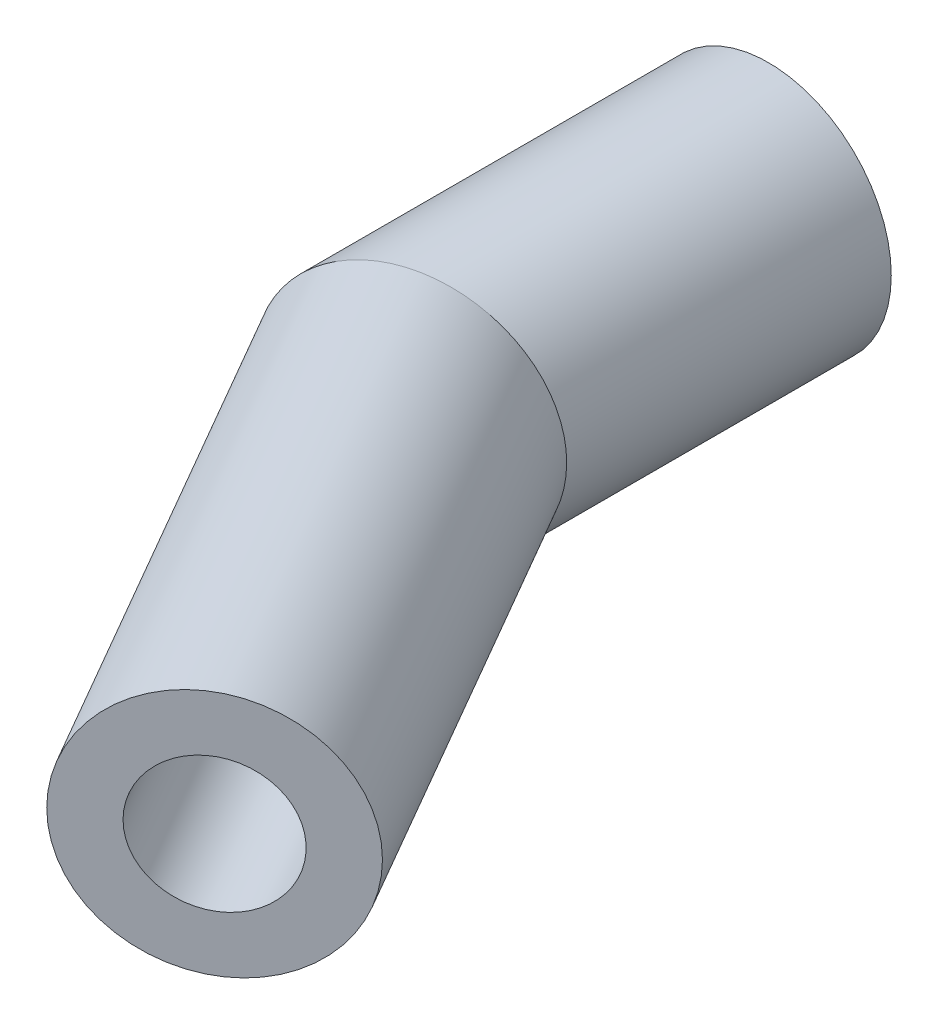
from build123d import *

# Parameters (mm, degrees)
SWEEP1_PROFILE_R     = 8.73125
CUT_SWEEP1_PROFILE_R = 4.7625


with BuildPart() as part:
    # Sweep1: sweep along a curve in space
    with BuildLine() as sweep1_path:
        Line((0, 0, 0), (0, 0, 25.4))
        Line((0, 0, 25.4), (19.05, 0, 58.395567884))
    # Sweep1 profile (on start of the path) → Sweep1 (sweep)
    with BuildSketch(Plane.XY):
        Circle(SWEEP1_PROFILE_R)
    sweep(path=sweep1_path.line, transition=Transition.RIGHT)

    # Cut-Sweep1: sweep along a curve in space
    with BuildLine() as cut_sweep1_path:
        Line((0, 0, 0), (0, 0, 25.4))
        Line((0, 0, 25.4), (19.05, 0, 58.395567884))
    # Cut-Sweep1 profile (on start of the path) → Cut-Sweep1 (sweep, cut)
    with BuildSketch(Plane.XY):
        Circle(CUT_SWEEP1_PROFILE_R)
    sweep(path=cut_sweep1_path.line, transition=Transition.RIGHT, mode=Mode.SUBTRACT)


solid = part.part
